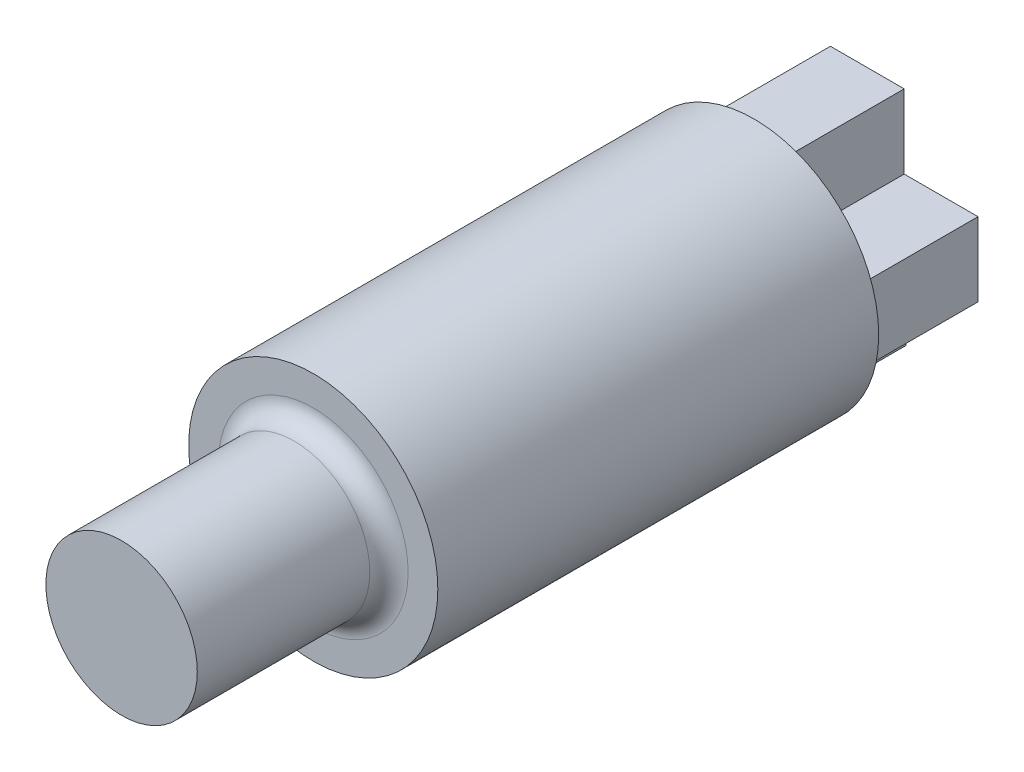
from build123d import *

# Parameters (mm, degrees)
CROQUIS1_R              = 6.5
SALIENTE_EXTRUIR1_DEPTH = 23
CROQUIS2_R              = 3.95
SALIENTE_EXTRUIR2_DEPTH = 10
REDONDEO1_R             = 1
SALIENTE_EXTRUIR3_DEPTH = 6


with BuildPart() as part:
    # Croquis1 → Saliente-Extruir1 (new body)
    with BuildSketch(Plane.XY):
        Circle(CROQUIS1_R)
    extrude(amount=SALIENTE_EXTRUIR1_DEPTH)

    # Croquis2 → Saliente-Extruir2 (add)
    with BuildSketch(Plane.XY.offset(23)):
        Circle(CROQUIS2_R)
    extrude(amount=SALIENTE_EXTRUIR2_DEPTH)

    # Redondeo1
    redondeo1_edges = [part.edges().sort_by_distance(p)[0] for p in [
        (-3.95, 0, 23),
    ]]
    fillet(redondeo1_edges, radius=REDONDEO1_R)

    # Croquis3 → Saliente-Extruir3 (add)
    with BuildSketch(Plane(origin=(0, 0, 0), x_dir=(-1, 0, 0), z_dir=(0, 0, -1))):
        Polygon((-1.830695776, 5.775), (2.019304224, 5.775), (2.019304224, 1.925), (5.775, 1.925), (5.775, -1.925), (1.925, -1.925), (1.925, -5.775), (-1.925, -5.775), (-1.925, -1.925), (-5.680695776, -1.925), (-5.680695776, 1.925), (-1.830695776, 1.925), align=None)
    extrude(amount=SALIENTE_EXTRUIR3_DEPTH)


solid = part.part
